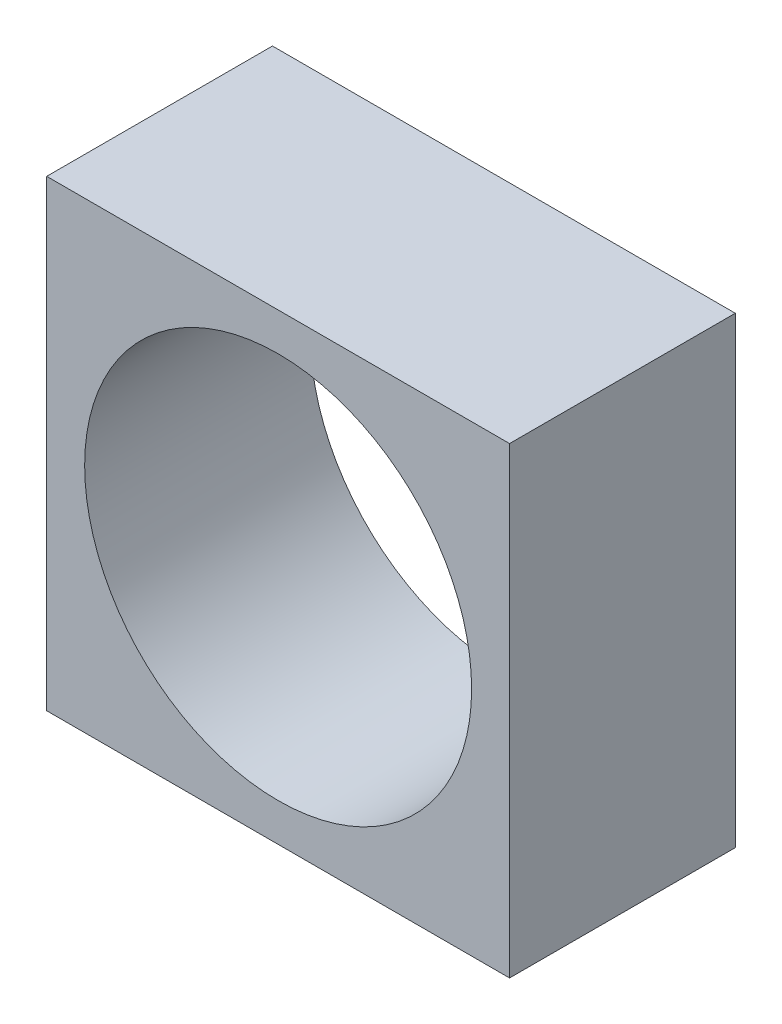
from build123d import *

# Parameters (mm, degrees)
SKETCH1_W           = 6.1
SKETCH1_H           = 6.1
BOSS_EXTRUDE1_DEPTH = 2.975
CUT_EXTRUDE1_REACH  = 11.125
SKETCH2_R           = 2.55


with BuildPart() as part:
    # Sketch1 → Boss-Extrude1 (new body)
    with BuildSketch(Plane.XY):
        with Locations((3.05, 3.05)):
            Rectangle(SKETCH1_W, SKETCH1_H)
    extrude(amount=BOSS_EXTRUDE1_DEPTH)

    # Sketch2 → Cut-Extrude1 (cut, up to next)
    with BuildSketch(Plane.XY.offset(2.975), mode=Mode.PRIVATE) as cut_extrude1_sk1:
        with Locations((3.05, 3.05)):
            Circle(SKETCH2_R)
    cut_extrude1_tool1 = extrude(cut_extrude1_sk1.sketch, amount=-CUT_EXTRUDE1_REACH, mode=Mode.PRIVATE) & part.part
    add(cut_extrude1_tool1.solids().sort_by_distance((3.05, 3.05, 2.975))[0], mode=Mode.SUBTRACT)


solid = part.part
